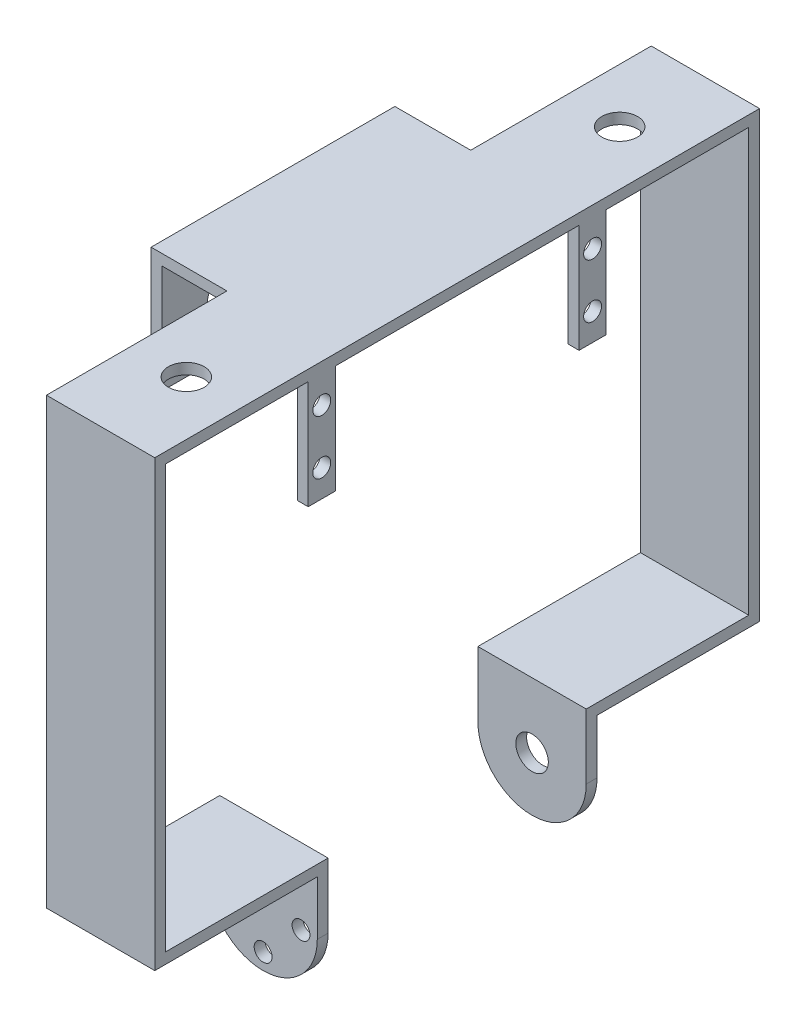
from build123d import *

# Parameters (mm, degrees)
EXTRUDE_1_DEPTH     = 2
SKETCH_2_R          = 1.65
CUT_EXTRUDE_1_DEPTH = 2
SKETCH_3_W          = 20
SKETCH_3_H          = 2
EXTRUDE_2_DEPTH     = 30
SKETCH_4_W          = 20
SKETCH_4_H          = 2
EXTRUDE_3_DEPTH     = 80
SKETCH_5_W          = 20
SKETCH_5_H          = 2
EXTRUDE_4_DEPTH     = 109.65
SKETCH_6_W          = 20
SKETCH_6_H          = 2
EXTRUDE_5_DEPTH     = 80
CUT_EXTRUDE_2_REACH = 126.622
SKETCH_8_R          = 3
SKETCH_9_W          = 2
SKETCH_9_H          = 5
EXTRUDE_6_DEPTH     = 20
SKETCH_10_R         = 1.65
CUT_EXTRUDE_3_DEPTH = 20
SKETCH_11_R         = 3.3
CUT_EXTRUDE_4_DEPTH = 10
SKETCH_12_W         = 45
SKETCH_12_H         = 2
EXTRUDE_7_DEPTH     = 14
SKETCH_13_W         = 2
SKETCH_13_H         = 45
EXTRUDE_8_DEPTH     = 20
SKETCH_14_R         = 3
CUT_EXTRUDE_6_DEPTH = 20


with BuildPart() as part:
    # 草图1 → 凸台-拉伸1 (new body)
    with BuildSketch(Plane.XY):
        with BuildLine():
            Line((0, 0), (0, 12))
            Line((0, 12), (20, 12))
            Line((20, 12), (20, 0))
            ThreePointArc((20, 0), (10, -10), (0, 0))
        make_face()
    extrude_1 = extrude(amount=EXTRUDE_1_DEPTH)

    # 草图2 → 切除-拉伸1 (cut)
    with BuildSketch(Plane.XY.offset(2)):
        with Locations((17, 0)):
            Circle(SKETCH_2_R)
        with Locations((10, -7)):
            Circle(SKETCH_2_R)
        with Locations((3, 0)):
            Circle(SKETCH_2_R)
        with Locations((10, 7)):
            Circle(SKETCH_2_R)
    extrude(amount=-CUT_EXTRUDE_1_DEPTH, mode=Mode.SUBTRACT)

    # 草图3 → 凸台-拉伸2 (add)
    with BuildSketch(Plane.XY.offset(2)):
        with Locations((10, 11)):
            Rectangle(SKETCH_3_W, SKETCH_3_H)
    extrude_2 = extrude(amount=EXTRUDE_2_DEPTH)

    # 草图4 → 凸台-拉伸3 (add)
    with BuildSketch(Plane(origin=(0, 12, 0), x_dir=(1, 0, 0), z_dir=(0, 1, 0))):
        with Locations((10, -31)):
            Rectangle(SKETCH_4_W, SKETCH_4_H)
    extrude(amount=EXTRUDE_3_DEPTH)

    # 草图5 → 凸台-拉伸4 (add)
    with BuildSketch(Plane(origin=(0, 0, 30), x_dir=(-1, 0, 0), z_dir=(0, 0, -1))):
        with Locations((-10, 91)):
            Rectangle(SKETCH_5_W, SKETCH_5_H)
    extrude(amount=EXTRUDE_4_DEPTH)

    # 草图6 → 凸台-拉伸5 (add)
    with BuildSketch(Plane.XZ.offset(-90)):
        with Locations((10, -78.65)):
            Rectangle(SKETCH_6_W, SKETCH_6_H)
    extrude(amount=EXTRUDE_5_DEPTH)

    # 镜向2: 凸台-拉伸2 across plane
    add(extrude_2.mirror(Plane.XY.offset(-23.825)))

    # 镜向3: 凸台-拉伸1 across plane
    add(extrude_1.mirror(Plane.XY.offset(-23.825)))

    # 草图8 → 切除-拉伸2 (cut, up to next)
    with BuildSketch(Plane(origin=(0, 0, -49.65), x_dir=(-1, 0, 0), z_dir=(0, 0, -1)), mode=Mode.PRIVATE) as cut_extrude_2_sk1:
        with Locations((-10, 0)):
            Circle(SKETCH_8_R)
    cut_extrude_2_tool1 = extrude(cut_extrude_2_sk1.sketch, amount=-CUT_EXTRUDE_2_REACH, mode=Mode.PRIVATE) & part.part
    add(cut_extrude_2_tool1.solids().sort_by_distance((10, 0, -49.65))[0], mode=Mode.SUBTRACT)

    # 草图9 → 凸台-拉伸6 (add)
    with BuildSketch(Plane.XZ.offset(-90)):
        with Locations((19, 1.175)):
            Rectangle(SKETCH_9_W, SKETCH_9_H)
        with Locations((19, -48.825)):
            Rectangle(SKETCH_9_W, SKETCH_9_H)
    extrude(amount=EXTRUDE_6_DEPTH)

    # 草图10 → 切除-拉伸3 (cut)
    with BuildSketch(Plane(origin=(20, 0, 0), x_dir=(0, 0, -1), z_dir=(1, 0, 0))):
        with Locations((-1.175, 75)):
            Circle(SKETCH_10_R)
        with Locations((-1.175, 85)):
            Circle(SKETCH_10_R)
        with Locations((48.825, 75)):
            Circle(SKETCH_10_R)
        with Locations((48.825, 85)):
            Circle(SKETCH_10_R)
    extrude(amount=-CUT_EXTRUDE_3_DEPTH, mode=Mode.SUBTRACT)

    # 草图11 → 切除-拉伸4 (cut)
    with BuildSketch(Plane(origin=(0, 92, 0), x_dir=(1, 0, 0), z_dir=(0, 1, 0))):
        with Locations(Location((10, 63.825, 0), (0, 0, 270))):
            Circle(SKETCH_11_R)
        with Locations(Location((10, -16.175, 0), (0, 0, 270))):
            Circle(SKETCH_11_R)
    extrude(amount=-CUT_EXTRUDE_4_DEPTH, mode=Mode.SUBTRACT)

    # 草图12 → 凸台-拉伸7 (add)
    with BuildSketch(Plane.ZY):
        with Locations((-23.825, 91)):
            Rectangle(SKETCH_12_W, SKETCH_12_H)
    extrude(amount=EXTRUDE_7_DEPTH)

    # 草图13 → 凸台-拉伸8 (add)
    with BuildSketch(Plane.XZ.offset(-90)):
        with Locations((-13, -23.825)):
            Rectangle(SKETCH_13_W, SKETCH_13_H)
    extrude(amount=EXTRUDE_8_DEPTH)

    # 草图14 → 切除-拉伸6 (cut)
    with BuildSketch(Plane.ZY.offset(14)):
        with Locations((-12.725, 80)):
            Circle(SKETCH_14_R)
    extrude(amount=-CUT_EXTRUDE_6_DEPTH, mode=Mode.SUBTRACT)


solid = part.part
